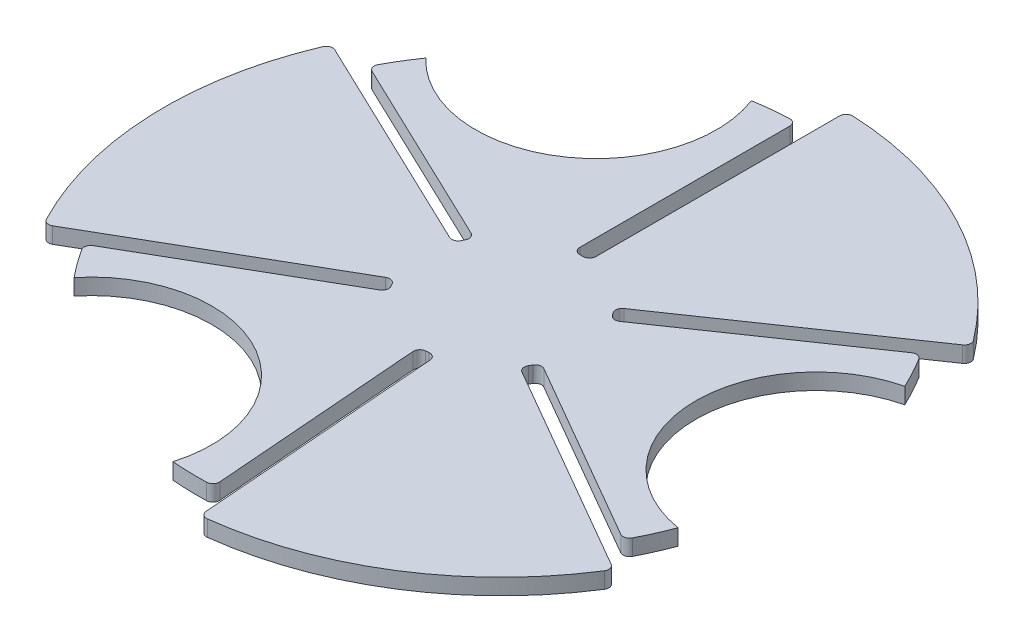
from build123d import *

# Parameters (mm, degrees)
EXTRUDE_1_DEPTH = 5
EXTRUDE_2_DEPTH = 5
FILLET_1_R      = 2


with BuildPart() as part:
    # 草圖1 → 填料-伸長1 (new body)
    with BuildSketch(Plane(origin=(0, 0, 0), x_dir=(1, 0, 0), z_dir=(0, 1, 0))):
        with BuildLine():
            Line((50.565945697, -26.307511014), (22.900635095, -10.334936491))
            Line((22.900635095, -10.334936491), (20.400635095, -14.665063509))
            Line((20.400635095, -14.665063509), (48.065945697, -30.637638033))
            ThreePointArc((48.065945697, -30.637638033), (30.4, -48.216594654), (6.922542226, -56.578073572))
            Line((6.922542226, -56.578073572), (4.437329437, -24.729741355))
            Line((4.437329437, -24.729741355), (-0.547516958, -25.118722602))
            Line((-0.547516958, -25.118722602), (1.93769583, -56.96705482))
            ThreePointArc((1.93769583, -56.96705482), (-26.556795854, -50.435469602), (-48.065945697, -30.637638033))
            Line((-48.065945697, -30.637638033), (-20.400635095, -14.665063509))
            Line((-20.400635095, -14.665063509), (-22.900635095, -10.334936491))
            Line((-22.900635095, -10.334936491), (-50.565945697, -26.307511014))
            ThreePointArc((-50.565945697, -26.307511014), (-56.956795854, -2.218874948), (-52.459320124, 22.29393936))
            Line((-52.459320124, 22.29393936), (-23.635248961, 8.522030659))
            Line((-23.635248961, 8.522030659), (-21.479693405, 13.033524896))
            Line((-21.479693405, 13.033524896), (-50.303764568, 26.805433596))
            ThreePointArc((-50.303764568, 26.805433596), (-30.4, 48.216594654), (-2.5, 56.945149047))
            Line((-2.5, 56.945149047), (-2.5, 25))
            Line((-2.5, 25), (2.5, 25))
            Line((2.5, 25), (2.5, 56.945149047))
            ThreePointArc((2.5, 56.945149047), (26.556795854, 50.435469602), (45.536777898, 34.284134212))
            Line((45.536777898, 34.284134212), (19.197919523, 16.207710695))
            Line((19.197919523, 16.207710695), (22.027210363, 12.085197706))
            Line((22.027210363, 12.085197706), (48.366068738, 30.161621224))
            ThreePointArc((48.366068738, 30.161621224), (56.956795854, 2.218874948), (50.565945697, -26.307511014))
        make_face()
    extrude(amount=-EXTRUDE_1_DEPTH)

    # 草圖4 → 填料-伸長2 (add)
    with BuildSketch(Plane(origin=(0, 0, 0), x_dir=(1, 0, 0), z_dir=(0, 1, 0))):
        with BuildLine():
            ThreePointArc((48.065945697, -30.637638033), (30.4, -48.216594654), (6.922542226, -56.578073572))
            Line((6.922542226, -56.578073572), (10.658713711, -104.457607775))
            ThreePointArc((10.658713711, -104.457607775), (56, -88.820042783), (89.656889178, -54.650180448))
            Line((89.656889178, -54.650180448), (48.065945697, -30.637638033))
        make_face()
        with BuildLine():
            Line((4.85674931, -94.375113172), (1.93769583, -56.96705482))
            ThreePointArc((1.93769583, -56.96705482), (-12.735400783, -55.559063769), (-26.556796584, -50.435469218))
            ThreePointArc((-26.556796584, -50.435469218), (-9.497439871, -68.99258523), (-8.040249963, -94.157338432))
            ThreePointArc((-8.040249963, -94.157338432), (-1.595470326, -94.486530651), (4.85674931, -94.375113172))
        make_face()
        with BuildLine():
            ThreePointArc((56.956795794, 2.218876491), (55.621252058, -12.460991916), (50.565945697, -26.307511014))
            Line((50.565945697, -26.307511014), (83.060757239, -45.068399205))
            ThreePointArc((83.060757239, -45.068399205), (85.942912679, -39.294602178), (88.424299029, -33.337566517))
            ThreePointArc((88.424299029, -33.337566517), (66.346381744, -21.173940759), (56.956795794, 2.218876491))
        make_face()
        with BuildLine():
            ThreePointArc((-73.083329018, -59.908906012), (-51.510362628, -46.870681896), (-26.556796584, -50.435469218))
            ThreePointArc((-26.556796584, -50.435469218), (-38.602162456, -41.938920512), (-48.065945697, -30.637638033))
            Line((-48.065945697, -30.637638033), (-80.560757239, -49.398526224))
            ThreePointArc((-80.560757239, -49.398526224), (-77.001580057, -54.781444566), (-73.083329018, -59.908906012))
        make_face()
        with BuildLine():
            ThreePointArc((48.366068738, 30.161621224), (54.483260678, 16.750352411), (56.956795794, 2.218876491))
            ThreePointArc((56.956795794, 2.218876491), (64.498052131, 26.271269361), (85.562772016, 40.115608495))
            ThreePointArc((85.562772016, 40.115608495), (82.625471022, 45.861547492), (79.302870836, 51.393624868))
            Line((79.302870836, 51.393624868), (48.366068738, 30.161621224))
        make_face()
        with BuildLine():
            Line((-92.156889178, -50.320053429), (-50.565945697, -26.307511014))
            ThreePointArc((-50.565945697, -26.307511014), (-56.956795854, -2.218874948), (-52.459320124, 22.29393936))
            Line((-52.459320124, 22.29393936), (-95.792298807, 42.998087042))
            ThreePointArc((-95.792298807, 42.998087042), (-104.920413415, -4.08740122), (-92.156889178, -50.320053429))
        make_face()
        with BuildLine():
            ThreePointArc((2.5, 56.945149047), (26.556795854, 50.435469602), (45.536777898, 34.284134212))
            Line((45.536777898, 34.284134212), (85.133585096, 61.459520733))
            ThreePointArc((85.133585096, 61.459520733), (48.920413415, 92.907444004), (2.5, 104.970233876))
            Line((2.5, 104.970233876), (2.5, 56.945149047))
        make_face()
        with BuildLine():
            Line((-84.159620147, 42.981488303), (-50.303764568, 26.805433596))
            ThreePointArc((-50.303764568, 26.805433596), (-41.747859976, 38.808712777), (-30.399998639, 48.216595512))
            ThreePointArc((-30.399998639, 48.216595512), (-55.000611157, 42.721316766), (-77.522522053, 54.041729936))
            ThreePointArc((-77.522522053, 54.041729936), (-81.030000696, 48.624983159), (-84.159620147, 42.981488303))
        make_face()
        with BuildLine():
            ThreePointArc((-30.399998639, 48.216595512), (-17.019088969, 54.399913701), (-2.5, 56.945149047))
            Line((-2.5, 56.945149047), (-2.5, 94.466925429))
            ThreePointArc((-2.5, 94.466925429), (-8.941332621, 94.076046744), (-15.34097001, 93.246472529))
            ThreePointArc((-15.34097001, 93.246472529), (-14.836019776, 68.044623914), (-30.399998639, 48.216595512))
        make_face()
    extrude(amount=-EXTRUDE_2_DEPTH)

    # 圓角1
    fillet_1_edges = [part.edges().sort_by_distance(p)[0] for p in [
        (-80.560757239, -2.5, 49.398526224),
        (4.85674931, -2.5, 94.375113172),
        (-84.159620147, -2.5, -42.981488303),
        (-2.5, -2.5, -94.466925429),
        (79.302870836, -2.5, -51.393624868),
        (83.060757239, -2.5, 45.068399205),
        (4.437329437, -2.5, 24.729741355),
        (-0.547516958, -2.5, 25.118722602),
        (-20.400635095, -2.5, 14.665063509),
        (-22.900635095, -2.5, 10.334936491),
        (-23.635248961, -2.5, -8.522030659),
        (-21.479693405, -2.5, -13.033524896),
        (-2.5, -2.5, -25),
        (2.5, -2.5, -25),
        (19.197919523, -2.5, -16.207710695),
        (22.027210363, -2.5, -12.085197706),
        (22.900635095, -2.5, 10.334936491),
        (20.400635095, -2.5, 14.665063509),
        (-95.792298807, -2.5, -42.998087042),
        (-92.156889178, -2.5, 50.320053429),
        (10.658713711, -2.5, 104.457607775),
        (89.656889178, -2.5, 54.650180448),
        (85.133585096, -2.5, -61.459520733),
        (2.5, -2.5, -104.970233876),
    ]]
    fillet(fillet_1_edges, radius=FILLET_1_R)


solid = part.part
